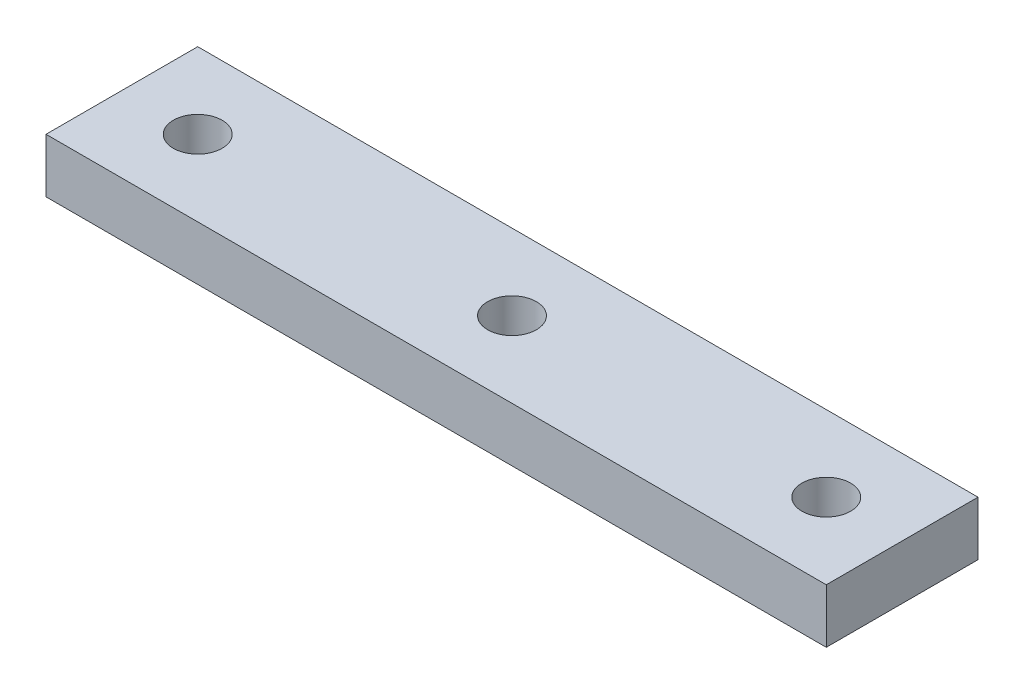
from build123d import *

# Parameters (mm, degrees)
SKETCH1_W           = 72
SKETCH1_H           = 14
SKETCH1_R           = 2.25
BOSS_EXTRUDE1_DEPTH = 5


with BuildPart() as part:
    # Sketch1 → Boss-Extrude1 (new body)
    with BuildSketch(Plane(origin=(0, 0, 0), x_dir=(1, 0, 0), z_dir=(0, 1, 0))):
        Rectangle(SKETCH1_W, SKETCH1_H)
        with Locations(Location((0, 0, 0), (0, 0, 270))):
            Circle(SKETCH1_R, mode=Mode.SUBTRACT)
        with Locations(Location((29, 0, 0), (0, 0, 270))):
            Circle(SKETCH1_R, mode=Mode.SUBTRACT)
        with Locations(Location((-29, 0, 0), (0, 0, 270))):
            Circle(SKETCH1_R, mode=Mode.SUBTRACT)
    extrude(amount=BOSS_EXTRUDE1_DEPTH)


solid = part.part
